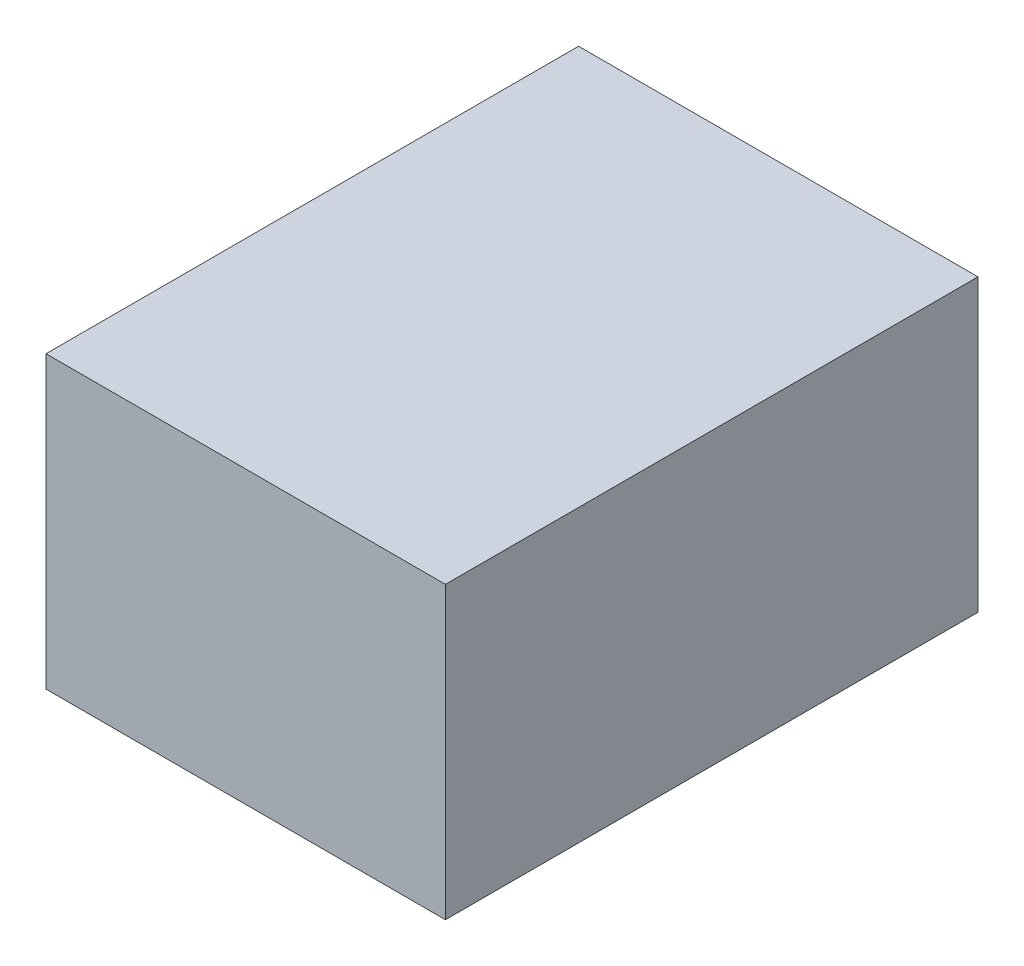
from build123d import *

# Parameters (mm, degrees)
SKETCH2_W           = 838.2
SKETCH2_H           = 609.6
BOSS_EXTRUDE1_DEPTH = 1117.6
SHELL1_T            = 6.35


with BuildPart() as part:
    # Sketch2 → Boss-Extrude1 (new body)
    with BuildSketch(Plane.XY):
        with Locations((419.1, 304.8)):
            Rectangle(SKETCH2_W, SKETCH2_H)
    extrude(amount=BOSS_EXTRUDE1_DEPTH)

    # Shell1 (no face opened: a closed hollow body)
    add(offset(amount=-SHELL1_T, mode=Mode.PRIVATE), mode=Mode.SUBTRACT)


solid = part.part
